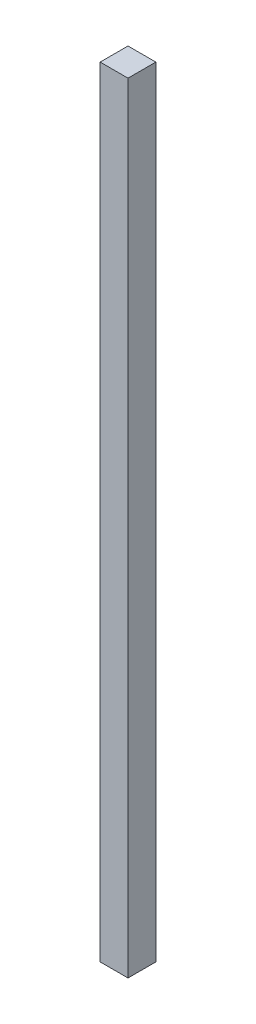
from build123d import *

# Parameters (mm, degrees)
SKETCH1_W           = 25
SKETCH1_H           = 25
BOSS_EXTRUDE1_DEPTH = 700


with BuildPart() as part:
    # Sketch1 → Boss-Extrude1 (new body)
    with BuildSketch(Plane(origin=(0, 0, 0), x_dir=(1, 0, 0), z_dir=(0, 1, 0))):
        with Locations((-12.5, -12.5)):
            Rectangle(SKETCH1_W, SKETCH1_H)
    extrude(amount=BOSS_EXTRUDE1_DEPTH)


solid = part.part
